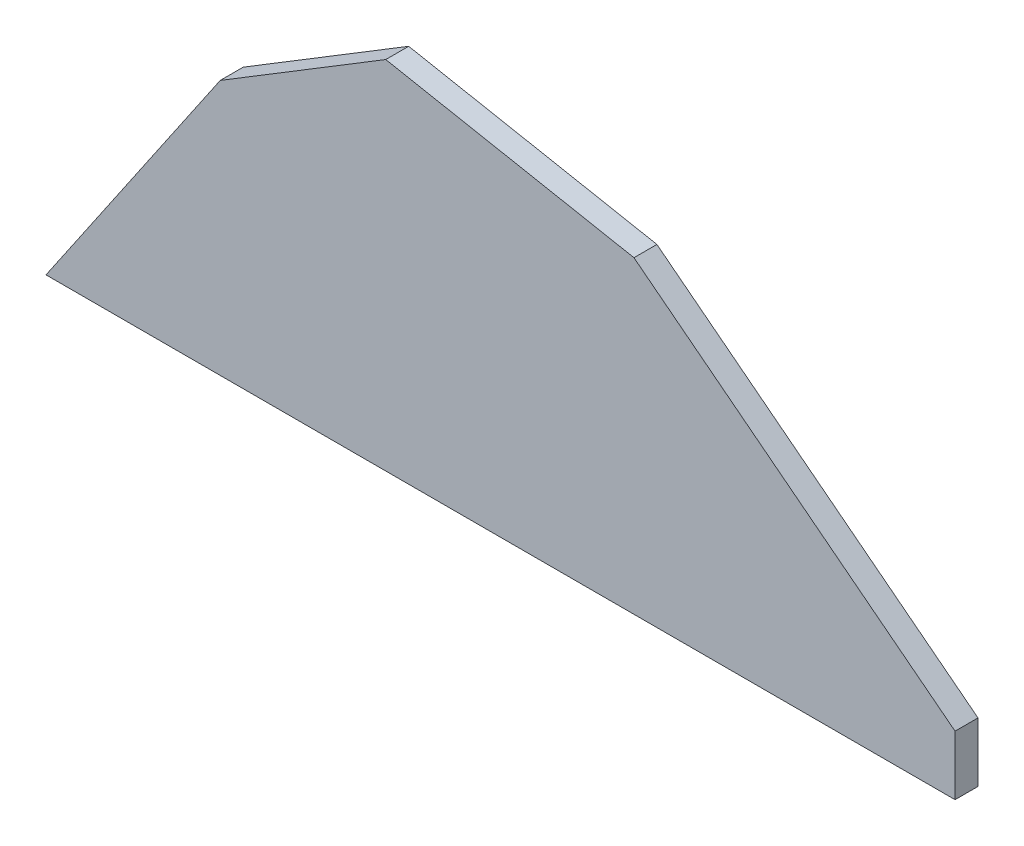
from build123d import *

# Parameters (mm, degrees)
BOSS_EXTRUDE1_DEPTH = 2.5


with BuildPart() as part:
    # Sketch1 → Boss-Extrude1 (new, symmetric)
    with BuildSketch(Plane.XY):
        Polygon((-99.06, -36.437000587), (99.06, -36.437000587), (99.06, -23.495700587), (29.083, 30.872999413), (-25.019, 41.223499413), (-61.087, 19.252499413), align=None)
    extrude(amount=BOSS_EXTRUDE1_DEPTH, both=True)


solid = part.part
